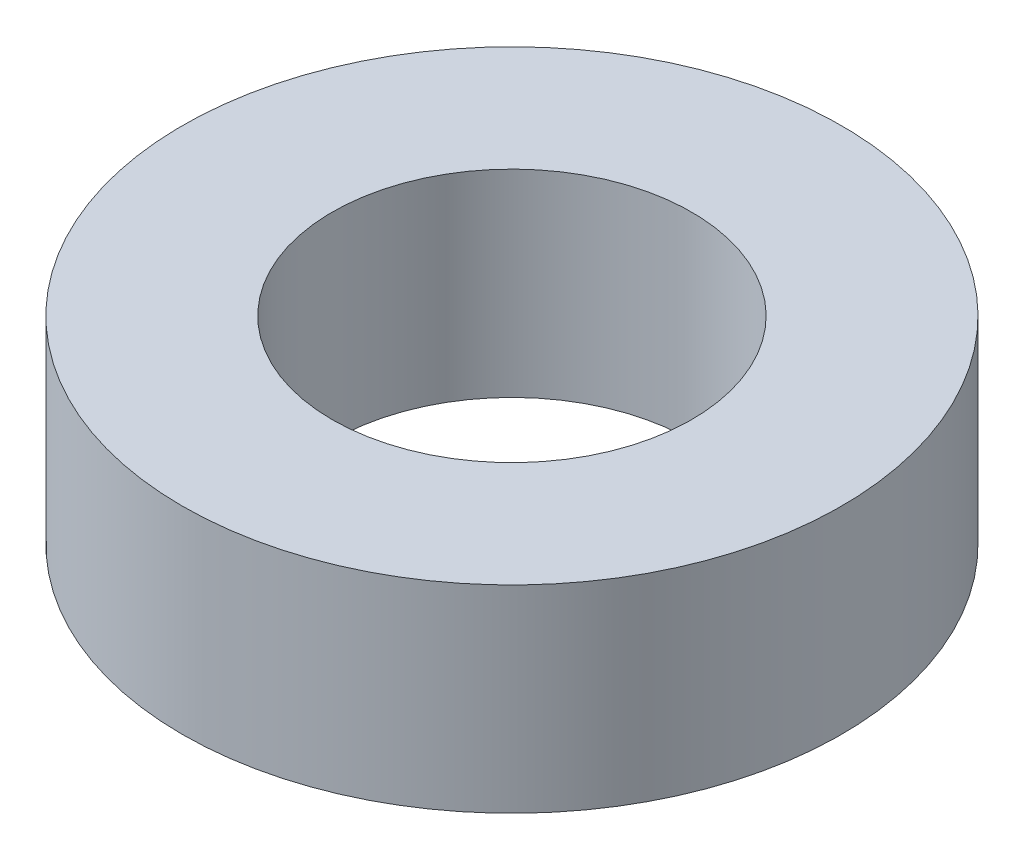
from build123d import *

# Parameters (mm, degrees)
SKETCH1_R           = 11
SKETCH1_R_2         = 6
BOSS_EXTRUDE1_DEPTH = 6.6


with BuildPart() as part:
    # Sketch1 → Boss-Extrude1 (new body)
    with BuildSketch(Plane(origin=(0, 0, 0), x_dir=(1, 0, 0), z_dir=(0, 1, 0))):
        Circle(SKETCH1_R)
        Circle(SKETCH1_R_2, mode=Mode.SUBTRACT)
    extrude(amount=BOSS_EXTRUDE1_DEPTH)


solid = part.part
